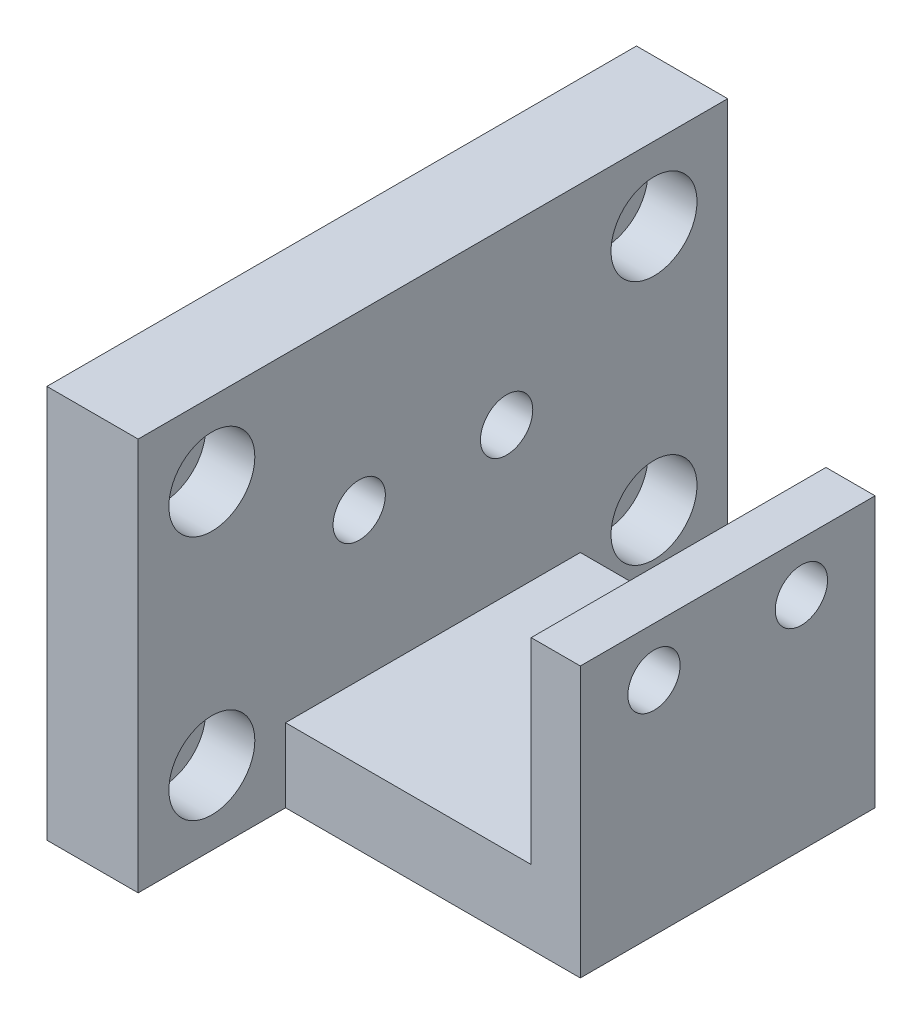
from build123d import *

# Parameters (mm, degrees)
SKETCH1_W                                        = 76.2
SKETCH1_H                                        = 50.8
BOSS_EXTRUDE1_DEPTH                              = 11.79269038
BOSS_EXTRUDE2_START                              = -38.1
BOSS_EXTRUDE2_DEPTH                              = 19.05
F_1_4_CLEARANCE_HOLE2_D                          = 6.7564
CBORE_FOR_1_4_SOCKET_HEAD_CAP_SCREW1_D           = 6.7564
CBORE_FOR_1_4_SOCKET_HEAD_CAP_SCREW1_CBORE_D     = 11.1125
CBORE_FOR_1_4_SOCKET_HEAD_CAP_SCREW1_CBORE_DEPTH = 6.35


with BuildPart() as part:
    # Sketch1 → Boss-Extrude1 (new body)
    with BuildSketch(Plane(origin=(0, 0, 0), x_dir=(0, 0, -1), z_dir=(1, 0, 0))):
        Rectangle(SKETCH1_W, SKETCH1_H)
    extrude(amount=BOSS_EXTRUDE1_DEPTH)

    # Sketch7 → Boss-Extrude2 (add, symmetric)
    with BuildSketch(Plane.XY.offset(38.1).offset(BOSS_EXTRUDE2_START)):
        Polygon((11.79269038, -25.4), (49.89269038, -25.4), (49.89269038, 9.525), (43.54269038, 9.525), (43.54269038, -15.875), (11.79269038, -15.875), align=None)
    extrude(amount=BOSS_EXTRUDE2_DEPTH, both=True)

    # 1/4 Clearance Hole2 (through all)
    with Locations(Plane(origin=(49.89269038, 0, 0), x_dir=(0, 0, -1), z_dir=(1, 0, 0))):
        with Locations((-9.525, 3.175), (9.525, 3.175)):
            Hole(F_1_4_CLEARANCE_HOLE2_D / 2)

    # CBORE for 1/4 Socket Head Cap Screw1 (through all)
    with Locations(Plane(origin=(11.79269038, 0, 0), x_dir=(0, 0, -1), z_dir=(1, 0, 0))):
        with Locations((-28.575, 15.875), (28.575, 15.875), (28.575, -15.875), (-28.575, -15.875)):
            CounterBoreHole(CBORE_FOR_1_4_SOCKET_HEAD_CAP_SCREW1_D / 2, CBORE_FOR_1_4_SOCKET_HEAD_CAP_SCREW1_CBORE_D / 2, CBORE_FOR_1_4_SOCKET_HEAD_CAP_SCREW1_CBORE_DEPTH)


solid = part.part
